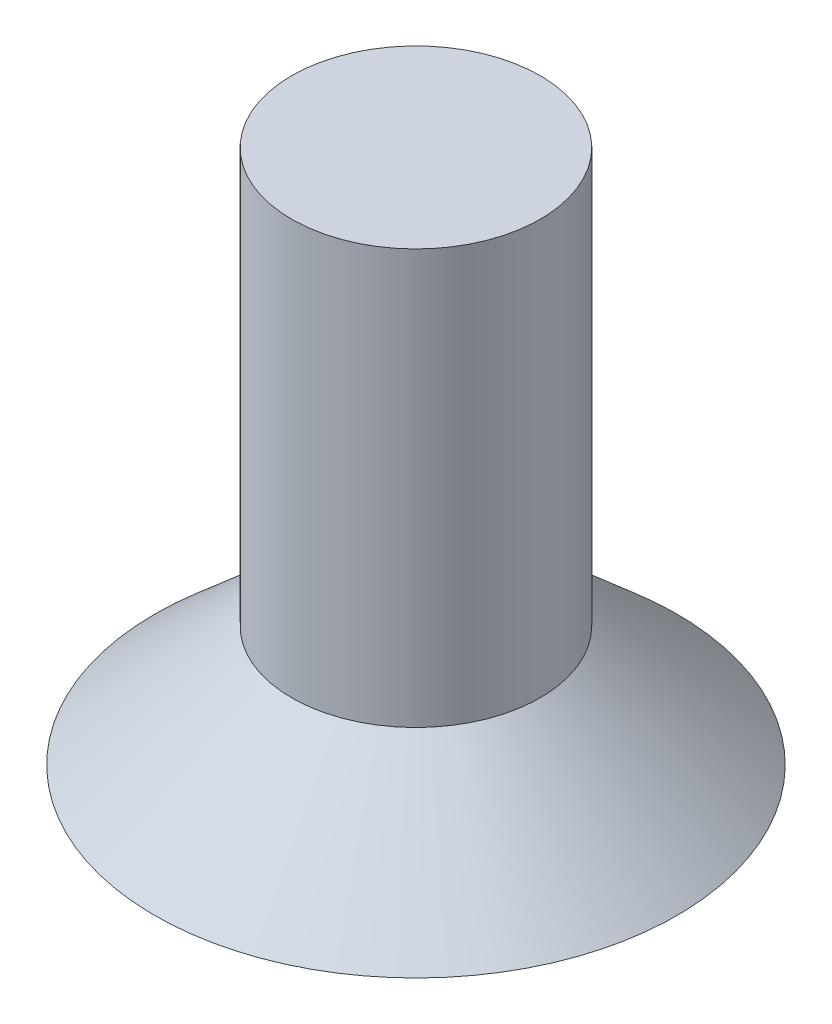
from build123d import *


with BuildPart() as part:
    # Sketch1 → Revolve1 (revolve)
    with BuildSketch(Plane.XY, mode=Mode.PRIVATE) as revolve1_sk:
        Polygon((0, 0), (3.15, 0), (1.5, 1.45), (1.5, 6.45), (0, 6.45), align=None)
    revolve(revolve1_sk.sketch.rotate(Axis((0, 6.45, 0), (0, -1, 0)), 180), axis=Axis((0, 6.45, 0), (0, -1, 0)))


solid = part.part
